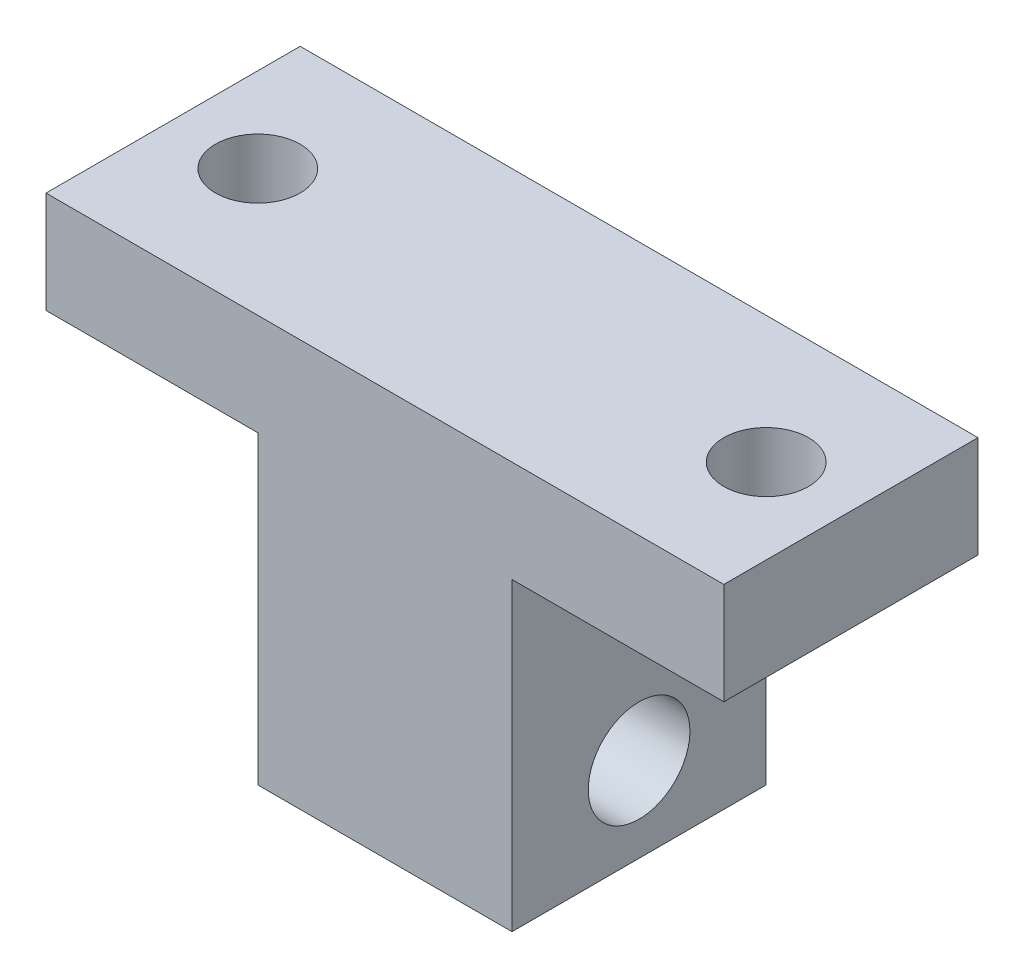
from build123d import *

# Parameters (mm, degrees)
EXTRUDE_1_DEPTH     = 15
SKETCH_2_R          = 2.5
CUT_EXTRUDE_1_DEPTH = 31.805843601
SKETCH_3_R          = 3
CUT_EXTRUDE_2_DEPTH = 40.462007045


with BuildPart() as part:
    # 草图1 → 凸台-拉伸1 (new body)
    with BuildSketch(Plane.XY):
        Polygon((-20, 0), (20, 0), (20, -6), (7.5, -6), (7.5, -24), (-7.5, -24), (-7.5, -6), (-20, -6), align=None)
    extrude(amount=EXTRUDE_1_DEPTH)

    # 草图2 → 切除-拉伸1 (cut, through all)
    with BuildSketch(Plane.XZ.offset(6)):
        with Locations(Location((15, 7.5, 0), (0, 0, 270))):
            Circle(SKETCH_2_R)
    cut_extrude_1 = extrude(amount=-CUT_EXTRUDE_1_DEPTH, mode=Mode.SUBTRACT)

    # 镜向1: 切除-拉伸1 across plane
    add(cut_extrude_1.mirror(Plane(origin=(0, 0, 0), x_dir=(0, 0, 1), z_dir=(1, 0, 0))), mode=Mode.SUBTRACT)

    # 草图3 → 切除-拉伸2 (cut, through all)
    with BuildSketch(Plane(origin=(7.5, 0, 0), x_dir=(0, 0, -1), z_dir=(1, 0, 0))):
        with Locations(Location((-7.5, -19, 0), (0, 0, 90))):
            Circle(SKETCH_3_R)
    extrude(amount=-CUT_EXTRUDE_2_DEPTH, mode=Mode.SUBTRACT)


solid = part.part
